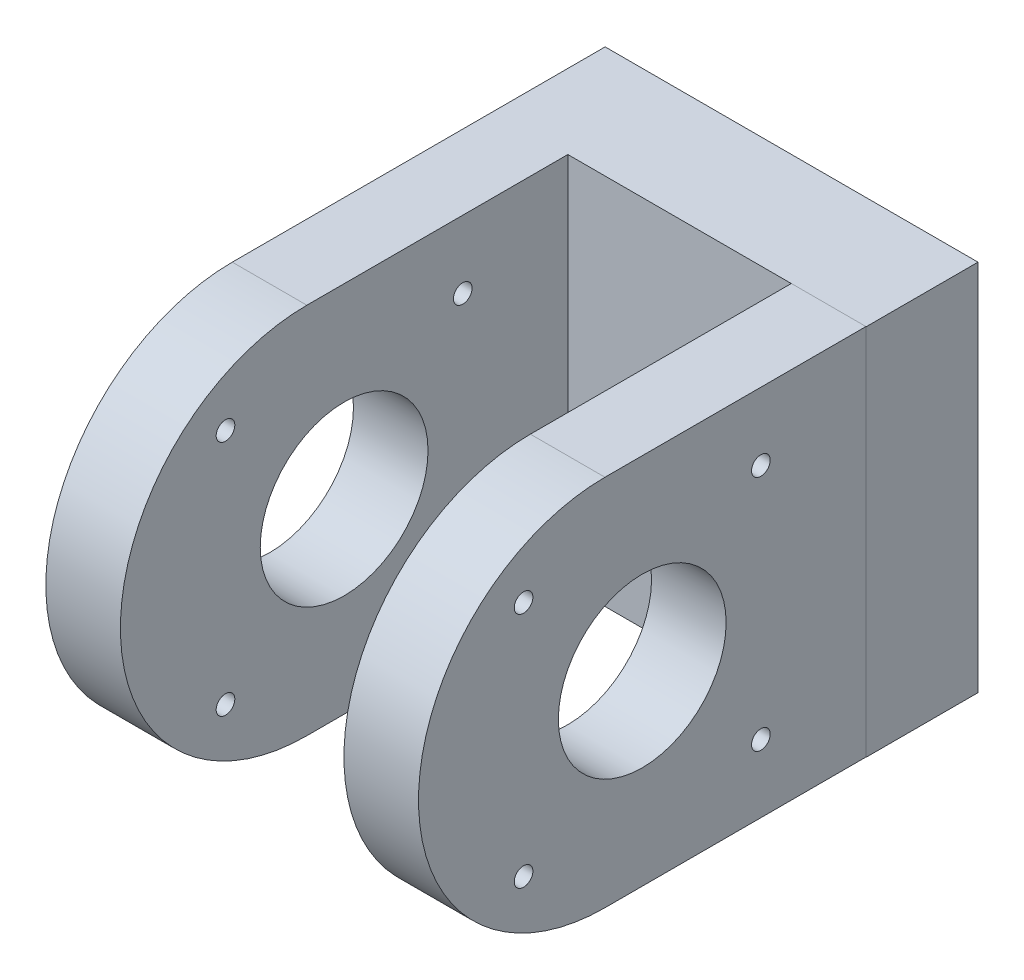
from build123d import *

# Parameters (mm, degrees)
CROQUIS1_W              = 50
CROQUIS1_H              = 50
CROQUIS1_R              = 2.5
SALIENTE_EXTRUIR1_DEPTH = 15
CROQUIS2_R              = 11.25
CROQUIS2_R_2            = 1.25
SALIENTE_EXTRUIR2_DEPTH = 10
SALIENTE_EXTRUIR3_DEPTH = 10


with BuildPart() as part:
    # Croquis1 → Saliente-Extruir1 (new body)
    with BuildSketch(Plane.XY):
        Rectangle(CROQUIS1_W, CROQUIS1_H)
        Circle(CROQUIS1_R, mode=Mode.SUBTRACT)
    extrude(amount=SALIENTE_EXTRUIR1_DEPTH)

    # Croquis2 → Saliente-Extruir2 (add)
    with BuildSketch(Plane.ZY.offset(25)):
        with BuildLine():
            Line((15, 25), (50, 25))
            ThreePointArc((50, 25), (75, 0), (50, -25))
            Line((50, -25), (15, -25))
            Line((15, -25), (15, 25))
        make_face()
        with Locations((45, 0)):
            Circle(CROQUIS2_R, mode=Mode.SUBTRACT)
        with Locations((60.909902577, -15.909902577)):
            Circle(CROQUIS2_R_2, mode=Mode.SUBTRACT)
        with Locations((60.909902577, 15.909902577)):
            Circle(CROQUIS2_R_2, mode=Mode.SUBTRACT)
        with Locations((29.090097423, 15.909902577)):
            Circle(CROQUIS2_R_2, mode=Mode.SUBTRACT)
        with Locations((29.090097423, -15.909902577)):
            Circle(CROQUIS2_R_2, mode=Mode.SUBTRACT)
    extrude(amount=-SALIENTE_EXTRUIR2_DEPTH)


with BuildPart() as body_2:
    # Croquis4 → Saliente-Extruir3 (new body)
    with BuildSketch(Plane(origin=(25, 0, 0), x_dir=(0, 0, -1), z_dir=(1, 0, 0))):
        with BuildLine():
            Line((-15.025995747, -24.965180979), (-15.025995747, 25.034819021))
            Line((-15.025995747, 25.034819021), (-50.025995747, 25.034819021))
            ThreePointArc((-50.025995747, 25.034819021), (-75.025995747, 0.034819021), (-50.025995747, -24.965180979))
            Line((-50.025995747, -24.965180979), (-15.025995747, -24.965180979))
        make_face()
        with BuildLine():
            ThreePointArc((-59.685898324, -15.875083556), (-62.090747739, -16.353437847), (-60.052014847, -14.99120008))
            ThreePointArc((-60.052014847, -14.99120008), (-59.781048908, -15.396729266), (-59.685898324, -15.875083556))
        make_face(mode=Mode.SUBTRACT)
        with BuildLine():
            ThreePointArc((-27.86609317, -15.875083556), (-29.594447461, -17.029932972), (-29.999976647, -14.99120008))
            ThreePointArc((-29.999976647, -14.99120008), (-28.63773888, -14.72023414), (-27.86609317, -15.875083556))
        make_face(mode=Mode.SUBTRACT)
        with BuildLine():
            ThreePointArc((-59.685898324, 15.944721597), (-59.781048908, 15.466367307), (-60.052014847, 15.060838121))
            ThreePointArc((-60.052014847, 15.060838121), (-62.090747739, 16.423075888), (-59.685898324, 15.944721597))
        make_face(mode=Mode.SUBTRACT)
        with BuildLine():
            ThreePointArc((-33.775995747, 0.034819021), (-34.632351006, -4.270369594), (-37.071044459, -7.920132268))
            ThreePointArc((-37.071044459, -7.920132268), (-45.025995747, -11.215180979), (-52.980947035, -7.920132268))
            ThreePointArc((-52.980947035, -7.920132268), (-56.275995747, 0.034819021), (-52.980947035, 7.989770309))
            ThreePointArc((-52.980947035, 7.989770309), (-45.025995747, 11.284819021), (-37.071044459, 7.989770309))
            ThreePointArc((-37.071044459, 7.989770309), (-34.632351006, 4.340007635), (-33.775995747, 0.034819021))
        make_face(mode=Mode.SUBTRACT)
        with BuildLine():
            ThreePointArc((-27.86609317, 15.944721597), (-28.63773888, 14.789872182), (-29.999976647, 15.060838121))
            ThreePointArc((-29.999976647, 15.060838121), (-29.594447461, 17.099571013), (-27.86609317, 15.944721597))
        make_face(mode=Mode.SUBTRACT)
    extrude(amount=-SALIENTE_EXTRUIR3_DEPTH)


solid = Compound([part.part, body_2.part])
